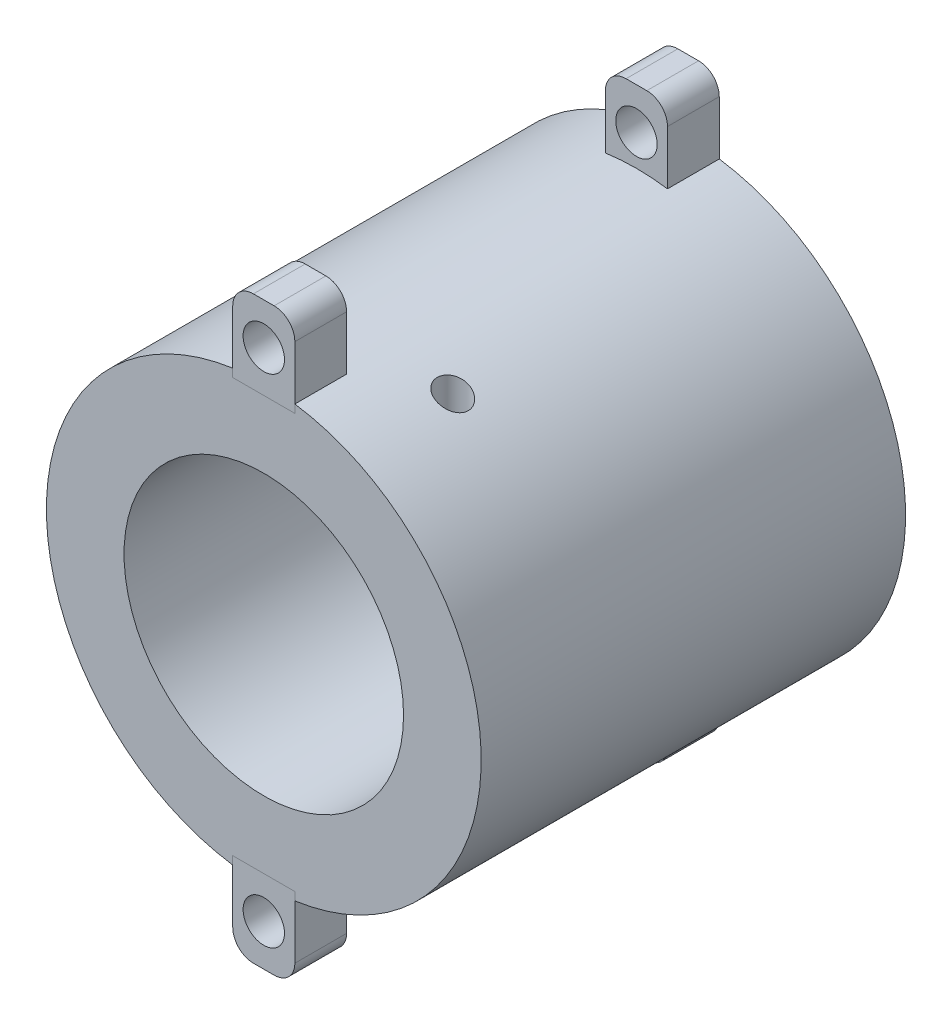
from build123d import *

# Parameters (mm, degrees)
SKETCH1_R                = 19.01
SKETCH1_R_2              = 13.5
BOSS_EXTRUDE1_DEPTH      = 18
BOSS_EXTRUDE2_DEPTH      = 23
BOSS_EXTRUDE2_DEPTH_BACK = 18
SKETCH2_R                = 21
SKETCH2_R_2              = 13.5
CUT_EXTRUDE1_DEPTH       = 13
MIRROR2_COPY_1_DEPTH     = 13
BOSS_EXTRUDE3_START      = -5
SKETCH4_W                = 6
SKETCH4_H                = 8
SKETCH4_R                = 2
BOSS_EXTRUDE3_DEPTH      = 5.0001
FILLET1_R                = 2
FILLET1_OF_MIRROR5_R     = 2
BOSS_EXTRUDE6_START      = 0.0001
SKETCH7_W                = 6
SKETCH7_H                = 8
SKETCH7_R                = 2
BOSS_EXTRUDE6_DEPTH      = 5.0001
FILLET2_R                = 2
CUT_EXTRUDE2_START       = -0.0001
SKETCH9_R                = 1.5
CUT_EXTRUDE2_DEPTH       = 20.0001


with BuildPart() as part:
    # Sketch1 → Boss-Extrude1 (new body)
    with BuildSketch(Plane.XY):
        Circle(SKETCH1_R)
        Circle(SKETCH1_R_2, mode=Mode.SUBTRACT)
    extrude(amount=BOSS_EXTRUDE1_DEPTH)

    # Sketch2 → Boss-Extrude2 (add, two sides: drawn at the far end of the back side and taken through both)
    with BuildSketch(Plane.XY.offset(18).offset(-BOSS_EXTRUDE2_DEPTH_BACK)):
        Circle(SKETCH2_R)
        Circle(SKETCH2_R_2, mode=Mode.SUBTRACT)
    extrude(amount=BOSS_EXTRUDE2_DEPTH + BOSS_EXTRUDE2_DEPTH_BACK)

    # Sketch3 → Cut-Extrude1 (cut)
    with BuildSketch(Plane(origin=(0, 0, 0), x_dir=(-1, 0, 0), z_dir=(0, 0, -1))):
        Polygon((15.540276616, 12.01617991), (10.937752349, 10.062524267), (14.845063634, 0.857475733), (19.447587901, 2.811131375), align=None)
    cut_extrude1 = extrude(amount=-CUT_EXTRUDE1_DEPTH, mode=Mode.SUBTRACT)

    # Mirror1: Cut-Extrude1 across plane
    add(cut_extrude1.mirror(Plane.ZX), mode=Mode.SUBTRACT)

    # Mirror2: Cut-Extrude1 across plane
    add(cut_extrude1.mirror(Plane(origin=(0, 0, 0), x_dir=(0, 0, 1), z_dir=(1, 0, 0))), mode=Mode.SUBTRACT)

    # Mirror2 copy 1 sketch → Mirror2 copy 1 (cut)
    with BuildSketch(Plane(origin=(0, 0, 0), x_dir=(1, 0, 0), z_dir=(0, 0, -1))):
        Polygon((15.540276616, 12.01617991), (10.937752349, 10.062524267), (14.845063634, 0.857475733), (19.447587901, 2.811131375), align=None)
    extrude(amount=-MIRROR2_COPY_1_DEPTH, mode=Mode.SUBTRACT)

    # Sketch4 → Boss-Extrude3 (add)
    with BuildSketch(Plane(origin=(0, 0, 0), x_dir=(-1, 0, 0), z_dir=(0, 0, -1)).offset(BOSS_EXTRUDE3_START)):
        with Locations((0, 24)):
            Rectangle(SKETCH4_W, SKETCH4_H)
        with Locations((0, 24)):
            Circle(SKETCH4_R, mode=Mode.SUBTRACT)
    boss_extrude3 = extrude(amount=BOSS_EXTRUDE3_DEPTH)

    # Fillet1
    fillet1_edges = [part.edges().sort_by_distance(p)[0] for p in [
        (-3, 28, 2.49995),
        (3, 28, 2.49995),
    ]]
    fillet(fillet1_edges, radius=FILLET1_R)

    # Mirror5: Boss-Extrude3 across plane
    add(boss_extrude3.mirror(Plane.ZX))

    # Fillet1 of Mirror5
    fillet1_of_mirror5_edges = [part.edges().sort_by_distance(p)[0] for p in [
        (-3, -28, 2.49995),
        (3, -28, 2.49995),
    ]]
    fillet(fillet1_of_mirror5_edges, radius=FILLET1_OF_MIRROR5_R)

    # Sketch7 → Boss-Extrude6 (add)
    with BuildSketch(Plane.XY.offset(41).offset(BOSS_EXTRUDE6_START)):
        with Locations((0, 24)):
            Rectangle(SKETCH7_W, SKETCH7_H)
        with Locations(Location((0, 24, 0), (0, 0, 180))):
            Circle(SKETCH7_R, mode=Mode.SUBTRACT)
    boss_extrude6 = extrude(amount=-BOSS_EXTRUDE6_DEPTH)

    # Mirror6: Boss-Extrude6 across plane
    add(boss_extrude6.mirror(Plane.ZX))

    # Fillet2
    fillet2_edges = [part.edges().sort_by_distance(p)[0] for p in [
        (-3, 28, 38.50005),
        (3, 28, 38.50005),
        (-3, -28, 38.50005),
        (3, -28, 38.50005),
    ]]
    fillet(fillet2_edges, radius=FILLET2_R)

    # Sketch9 → Cut-Extrude2 (cut)
    with BuildSketch(Plane(origin=(0, 0, 0), x_dir=(1, 0, 0), z_dir=(0, 1, 0)).offset(CUT_EXTRUDE2_START)):
        with Locations(Location((-8.25, -31, 0), (0, 0, 90))):
            Circle(SKETCH9_R)
    cut_extrude2 = extrude(amount=CUT_EXTRUDE2_DEPTH, mode=Mode.SUBTRACT)

    # Mirror7: Cut-Extrude2 across plane
    add(cut_extrude2.mirror(Plane(origin=(0, 0, 0), x_dir=(0, 0, 1), z_dir=(1, 0, 0))), mode=Mode.SUBTRACT)


solid = part.part
